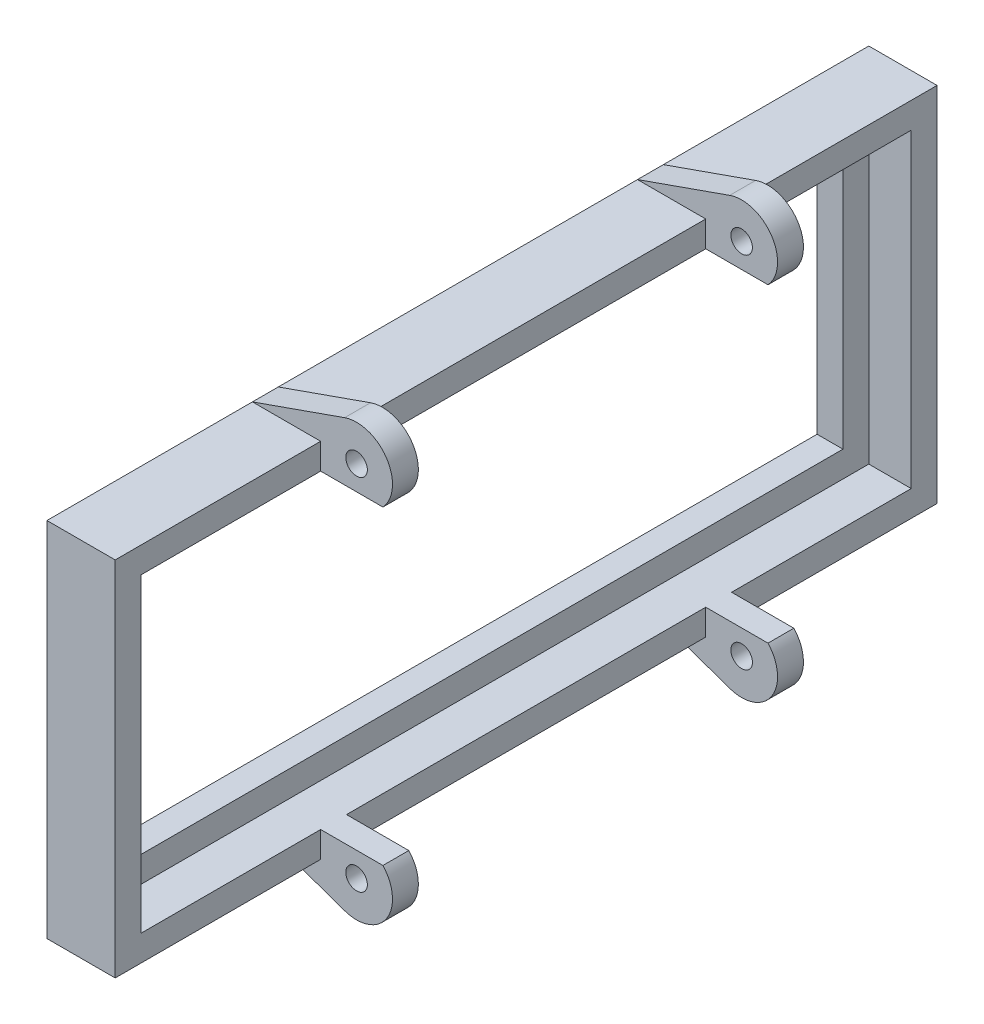
from build123d import *

# Parameters (mm, degrees)
SKETCH_1_W               = 114.4
SKETCH_1_H               = 50.4
SKETCH_1_W_2             = 100
SKETCH_1_H_2             = 36
EXTRUDE_1_DEPTH          = 3.6
SKETCH_1_3_W             = 114.4
SKETCH_1_3_H             = 50.4
SKETCH_1_3_W_2           = 107.2
SKETCH_1_3_H_2           = 43.2
EXTRUDE_2_DEPTH          = 9.5
EXTRUDE_START            = 25
SKETCH_2_R               = 1.5
EXTRUDE_3_DEPTH          = 3.6
MIRROR_START             = 25
MIRROR_2_COPY_1_SKETCH_R = 1.5
MIRROR_2_COPY_1_DEPTH    = 3.6


with BuildPart() as part:
    # 草图1 → 凸台-拉伸1 (new body)
    with BuildSketch(Plane(origin=(0, 0, 0), x_dir=(0, 0, -1), z_dir=(1, 0, 0))):
        Rectangle(SKETCH_1_W, SKETCH_1_H)
        Rectangle(SKETCH_1_W_2, SKETCH_1_H_2, mode=Mode.SUBTRACT)
    extrude(amount=EXTRUDE_1_DEPTH)

    # 草图1<3> → 凸台-拉伸2 (add)
    with BuildSketch(Plane(origin=(0, 0, 0), x_dir=(0, 0, -1), z_dir=(1, 0, 0))):
        Rectangle(SKETCH_1_3_W, SKETCH_1_3_H)
        Rectangle(SKETCH_1_3_W_2, SKETCH_1_3_H_2, mode=Mode.SUBTRACT)
    extrude(amount=EXTRUDE_2_DEPTH)

    # 草图2 → 凸台-拉伸3 (add)
    with BuildSketch(Plane.XY.offset(EXTRUDE_START)):
        with BuildLine():
            Line((12.840920286, 29.716720736), (0, 25.2))
            Line((0, 25.2), (0, 21.6))
            Line((0, 21.6), (9.5, 21.6))
            Line((9.5, 21.6), (18.166060556, 21.6))
            ThreePointArc((18.166060556, 21.6), (18.680583919, 27.74275739), (12.840920286, 29.716720736))
        make_face()
        with Locations((14.5, 25)):
            Circle(SKETCH_2_R, mode=Mode.SUBTRACT)
    extrude_3 = extrude(amount=EXTRUDE_3_DEPTH)

    # 镜向1: 凸台-拉伸3 across plane
    add(extrude_3.mirror(Plane.XY))

    # 镜向2: 凸台-拉伸3 across plane
    add(extrude_3.mirror(Plane.ZX))

    # 镜向2 copy 1 sketch → 镜向2 copy 1 (add)
    with BuildSketch(Plane(origin=(0, 0, 0), x_dir=(1, 0, 0), z_dir=(0, 0, -1)).offset(MIRROR_START)):
        with BuildLine():
            Line((12.840920286, 29.716720736), (0, 25.2))
            Line((0, 25.2), (0, 21.6))
            Line((0, 21.6), (9.5, 21.6))
            Line((9.5, 21.6), (18.166060556, 21.6))
            ThreePointArc((18.166060556, 21.6), (18.680583919, 27.74275739), (12.840920286, 29.716720736))
        make_face()
        with Locations((14.5, 25)):
            Circle(MIRROR_2_COPY_1_SKETCH_R, mode=Mode.SUBTRACT)
    extrude(amount=MIRROR_2_COPY_1_DEPTH)


solid = part.part
